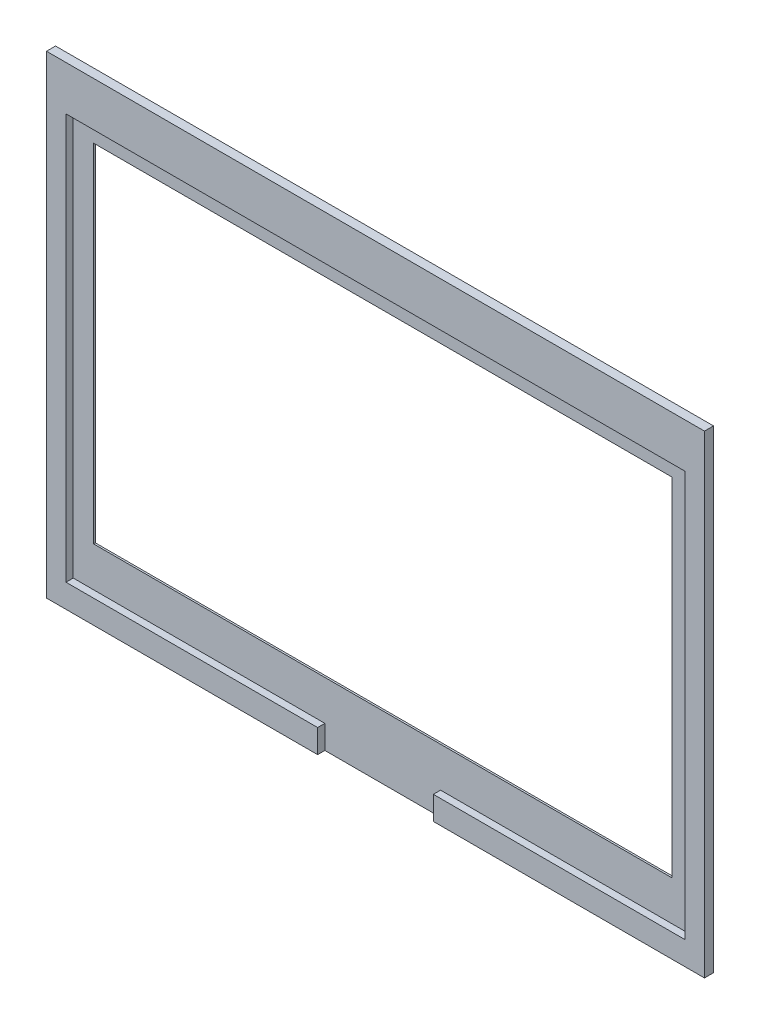
from build123d import *

# Parameters (mm, degrees)
ESBO_O1_W                = 182
ESBO_O1_H                = 131
ESBO_O1_W_2              = 171.2
ESBO_O1_H_2              = 112.2
RESSALTO_EXTRUS_O1_DEPTH = 2.5
ESBO_O1_4_W              = 171.2
ESBO_O1_4_H              = 112.2
ESBO_O1_4_W_2            = 160
ESBO_O1_4_H_2            = 96
RESSALTO_EXTRUS_O2_DEPTH = 0.5
ESBO_O2_W                = 32
ESBO_O2_H                = 30.698097853
CORTE_EXTRUS_O1_DEPTH    = 221.523241406


with BuildPart() as part:
    # Esboço1 → Ressalto-extrusão1 (new body)
    with BuildSketch(Plane.XY):
        with Locations((91, 65.5)):
            Rectangle(ESBO_O1_W, ESBO_O1_H)
        with Locations((91, 62.6)):
            Rectangle(ESBO_O1_W_2, ESBO_O1_H_2, mode=Mode.SUBTRACT)
    extrude(amount=RESSALTO_EXTRUS_O1_DEPTH)

    # Esboço1<4> → Ressalto-extrusão2 (add)
    with BuildSketch(Plane.XY):
        with Locations((91, 62.6)):
            Rectangle(ESBO_O1_4_W, ESBO_O1_4_H)
        with Locations((91, 65.5)):
            Rectangle(ESBO_O1_4_W_2, ESBO_O1_4_H_2, mode=Mode.SUBTRACT)
    extrude(amount=RESSALTO_EXTRUS_O2_DEPTH)

    # Esboço2 → Corte-extrusão1 (cut, through all)
    with BuildSketch(Plane(origin=(0, 6.5, 0), x_dir=(1, 0, 0), z_dir=(0, 1, 0))):
        with Locations((91, -15.849048927)):
            Rectangle(ESBO_O2_W, ESBO_O2_H)
    extrude(amount=-CORTE_EXTRUS_O1_DEPTH, mode=Mode.SUBTRACT)


solid = part.part
